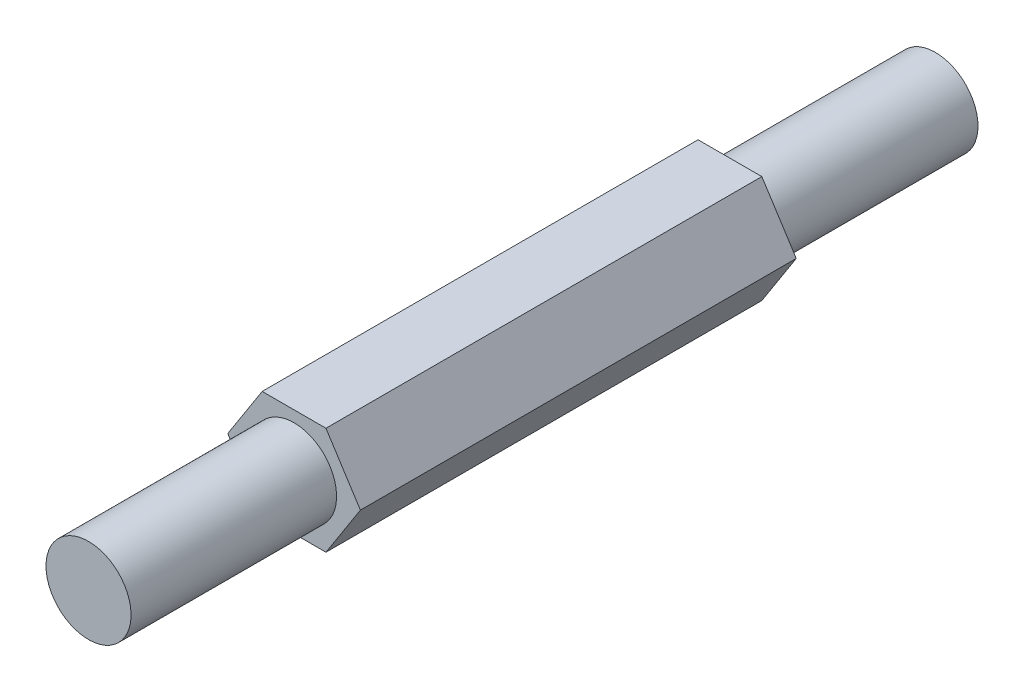
from build123d import *

# Parameters (mm, degrees)
BOSS_EXTRUDE1_DEPTH = 123
SKETCH2_R           = 12
BOSS_EXTRUDE2_DEPTH = 58
BOSS_EXTRUDE3_START = 58
SKETCH3_R           = 12
BOSS_EXTRUDE3_DEPTH = 58


with BuildPart() as part:
    # Sketch1 → Boss-Extrude1 (new body)
    with BuildSketch(Plane.XY):
        Polygon((-9, 15.15359655), (9, 15.15359655), (18.714345659, 0), (9, -15.15359655), (-9, -15.15359655), (-18.714345659, 0), align=None)
    extrude(amount=BOSS_EXTRUDE1_DEPTH)

    # Sketch2 → Boss-Extrude2 (add)
    with BuildSketch(Plane(origin=(0, 0, 0), x_dir=(-1, 0, 0), z_dir=(0, 0, -1))):
        with Locations(Location((0, 0, 0), (0, 0, 180))):
            Circle(SKETCH2_R)
    extrude(amount=BOSS_EXTRUDE2_DEPTH)

    # Sketch3 → Boss-Extrude3 (add)
    with BuildSketch(Plane.XY.offset(123).offset(BOSS_EXTRUDE3_START)):
        Circle(SKETCH3_R)
    extrude(amount=-BOSS_EXTRUDE3_DEPTH)


solid = part.part
